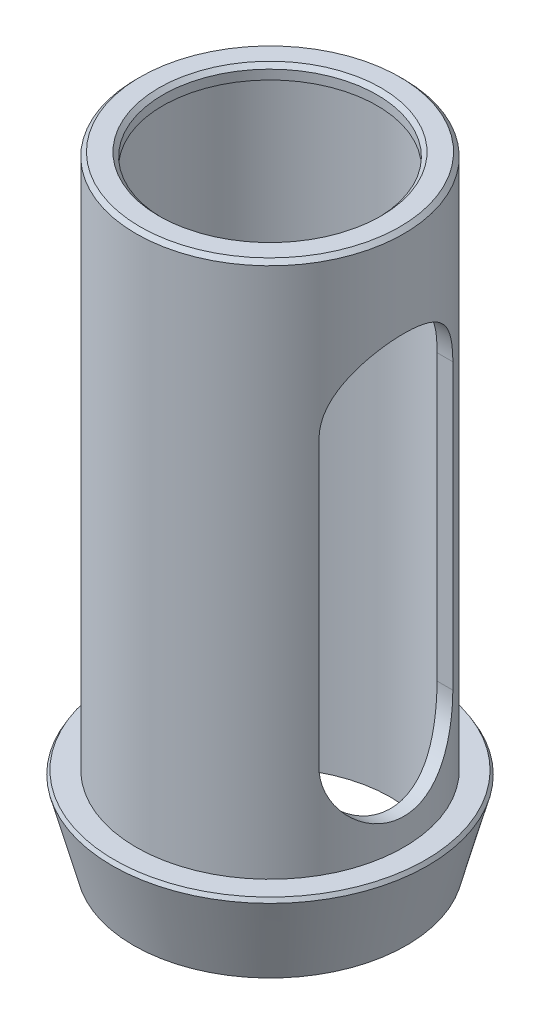
from build123d import *
from OCP.BRepFilletAPI import BRepFilletAPI_MakeChamfer

# Parameters (mm, degrees)
SKETCH1_R           = 25.908
BOSS_EXTRUDE1_DEPTH = 15.875
BOSS_EXTRUDE1_DRAFT = -15
SKETCH2_R           = 25.4
BOSS_EXTRUDE2_DEPTH = 101.6
SKETCH5_R           = 22.86
CUT_EXTRUDE2_DEPTH  = 114.935
SKETCH6_R           = 20.32
CUT_EXTRUDE3_DEPTH  = 2.54
CHAMFER1_SIZE       = 0.762
CHAMFER1_SIZE2      = 0.622170395
CUT_EXTRUDE6_DEPTH  = 7.62


with BuildPart() as part:
    # Sketch1 → Boss-Extrude1 (with draft: the straight prism first)
    with BuildSketch(Plane(origin=(0, 0, 0), x_dir=(1, 0, 0), z_dir=(0, 1, 0))):
        Circle(SKETCH1_R)
    extrude(amount=BOSS_EXTRUDE1_DEPTH)
    # Boss-Extrude1: the draft: its side faces are tilted about the plane it starts from
    boss_extrude1_sides = [part.faces().sort_by_distance(p)[0] for p in [
        (-25.908, 7.9375, 0),
    ]]
    draft(boss_extrude1_sides, Plane(origin=(0, 0, 0), x_dir=(1, 0, 0), z_dir=(0, 1, 0)), BOSS_EXTRUDE1_DRAFT)

    # Sketch2 → Boss-Extrude2 (add)
    with BuildSketch(Plane(origin=(0, 15.875, 0), x_dir=(1, 0, 0), z_dir=(0, 1, 0))):
        with Locations(Location((0, 0, 0), (0, 0, 270))):
            Circle(SKETCH2_R)
    extrude(amount=BOSS_EXTRUDE2_DEPTH)

    # Sketch5 → Cut-Extrude2 (cut)
    with BuildSketch(Plane.XZ):
        with Locations(Location((0, 0, 0), (0, 0, 270))):
            Circle(SKETCH5_R)
    extrude(amount=-CUT_EXTRUDE2_DEPTH, mode=Mode.SUBTRACT)

    # Sketch6 → Cut-Extrude3 (cut)
    with BuildSketch(Plane(origin=(0, 117.475, 0), x_dir=(1, 0, 0), z_dir=(0, 1, 0))):
        with Locations(Location((0, 0, 0), (0, 0, 270))):
            Circle(SKETCH6_R)
    extrude(amount=-CUT_EXTRUDE3_DEPTH, mode=Mode.SUBTRACT)

    # Chamfer1: one chamfer whose edges measure the first distance from different faces: ONE call of the kernel's chamfer builder (chamfer() names one face for all edges)
    chamfer1_edges_1 = [part.edges().sort_by_distance(p)[0] for p in [
        (0, 117.475, -20.32),
        (0, 117.475, -25.4),
    ]]
    chamfer1_edges_2 = [part.edges().sort_by_distance(p)[0] for p in [
        (-30.16169343, 15.875, 0),
    ]]
    chamfer1_side_2 = [part.faces().sort_by_distance(p)[0] for p in [
        (-28.034846715, 7.9375, 0),
    ]]
    chamfer1 = BRepFilletAPI_MakeChamfer(part.part.solid().wrapped)
    for e in chamfer1_edges_1:
        chamfer1.Add(CHAMFER1_SIZE, e.wrapped)
    for e in chamfer1_edges_2:
        chamfer1.Add(CHAMFER1_SIZE, CHAMFER1_SIZE2, e.wrapped, chamfer1_side_2[0].wrapped)  # the first distance lies on this face
    add(Compound.cast(chamfer1.Shape()), mode=Mode.REPLACE)

    # Sketch7 → Cut-Extrude6 (cut)
    with BuildSketch(Plane(origin=(25.4, 0, 0), x_dir=(0, 0, -1), z_dir=(1, 0, 0))):
        with BuildLine():
            Line((-12.7, 87.63), (-12.7, 33.655))
            ThreePointArc((-12.7, 33.655), (0, 20.955), (12.7, 33.655))
            Line((12.7, 33.655), (12.7, 87.63))
            ThreePointArc((12.7, 87.63), (0, 100.33), (-12.7, 87.63))
        make_face()
    extrude(amount=-CUT_EXTRUDE6_DEPTH, mode=Mode.SUBTRACT)


solid = part.part
